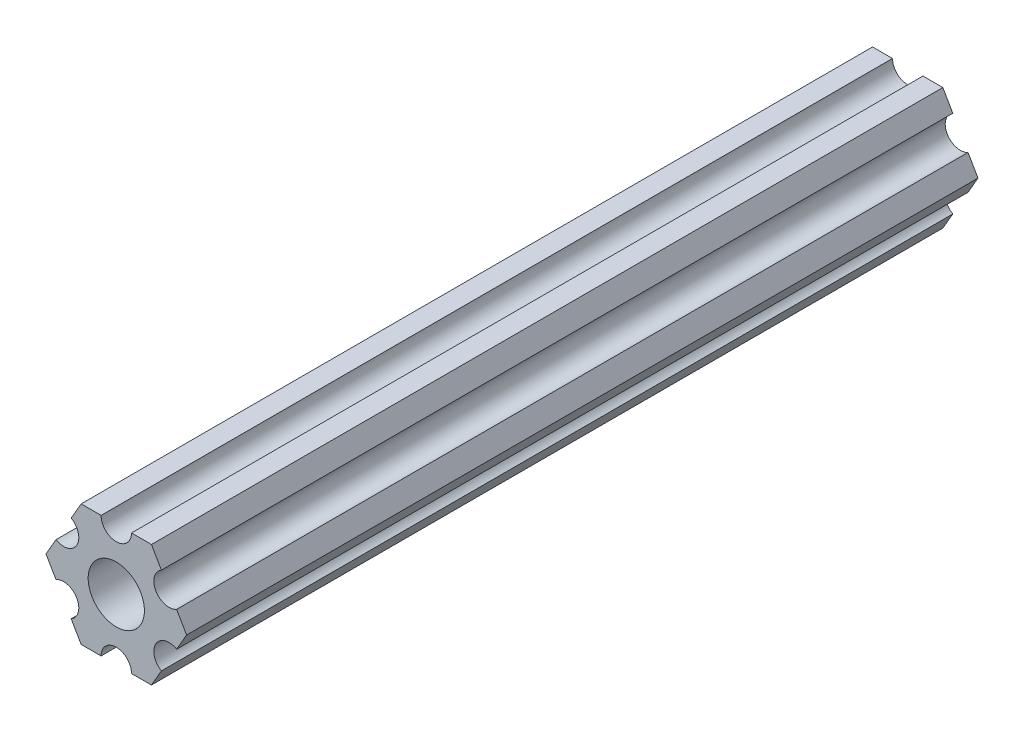
from build123d import *

# Parameters (mm, degrees)
SKETCH1_R           = 2.9337
BOSS_EXTRUDE1_DEPTH = 82.55


with BuildPart() as part:
    # Sketch1 → Boss-Extrude1 (new body)
    with BuildSketch(Plane.XY):
        with BuildLine():
            Line((-4.705511314, -4.549815329), (-3.666174209, -6.35))
            Line((-3.666174209, -6.35), (-1.5875, -6.35))
            ThreePointArc((-1.5875, -6.35), (0, -4.7625), (1.5875, -6.35))
            Line((1.5875, -6.35), (3.666174209, -6.35))
            Line((3.666174209, -6.35), (4.705511314, -4.549815329))
            ThreePointArc((4.705511314, -4.549815329), (4.124445986, -2.38125), (6.293011314, -1.800184671))
            Line((6.293011314, -1.800184671), (7.332348419, 0))
            Line((7.332348419, 0), (6.293011314, 1.800184671))
            ThreePointArc((6.293011314, 1.800184671), (4.124445986, 2.38125), (4.705511314, 4.549815329))
            Line((4.705511314, 4.549815329), (3.666174209, 6.35))
            Line((3.666174209, 6.35), (1.5875, 6.35))
            ThreePointArc((1.5875, 6.35), (0, 4.7625), (-1.5875, 6.35))
            Line((-1.5875, 6.35), (-3.666174209, 6.35))
            Line((-3.666174209, 6.35), (-4.705511314, 4.549815329))
            ThreePointArc((-4.705511314, 4.549815329), (-4.124445986, 2.38125), (-6.293011314, 1.800184671))
            Line((-6.293011314, 1.800184671), (-7.332348419, 0))
            Line((-7.332348419, 0), (-6.293011314, -1.800184671))
            ThreePointArc((-6.293011314, -1.800184671), (-4.124445986, -2.38125), (-4.705511314, -4.549815329))
        make_face()
        Circle(SKETCH1_R, mode=Mode.SUBTRACT)
    extrude(amount=BOSS_EXTRUDE1_DEPTH)


solid = part.part
